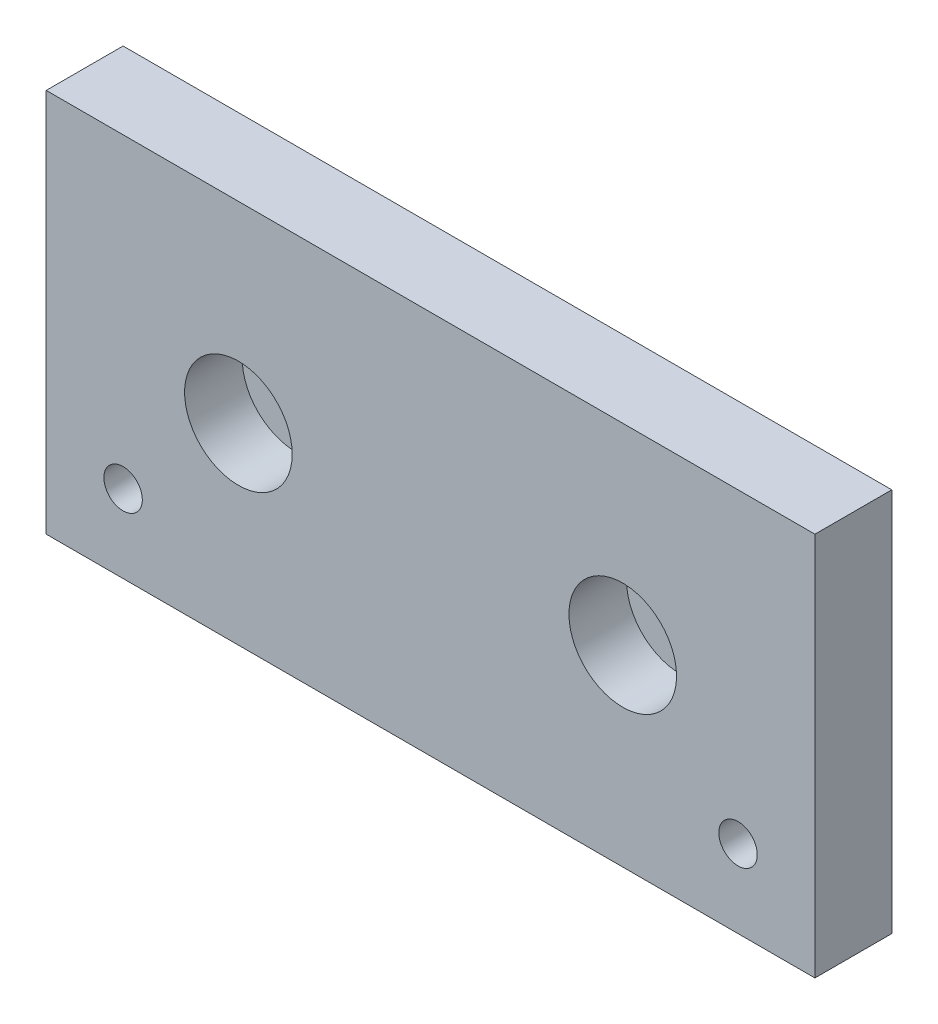
from build123d import *

# Parameters (mm, degrees)
SKETCH1_W           = 200
SKETCH1_H           = 100
BOSS_EXTRUDE1_DEPTH = 20
SKETCH2_R           = 14
CUT_EXTRUDE1_DEPTH  = 15
SKETCH4_R           = 5
CUT_EXTRUDE3_DEPTH  = 114.578166916


with BuildPart() as part:
    # Sketch1 → Boss-Extrude1 (new body)
    with BuildSketch(Plane.XY):
        Rectangle(SKETCH1_W, SKETCH1_H)
    extrude(amount=BOSS_EXTRUDE1_DEPTH)

    # Sketch2 → Cut-Extrude1 (cut)
    with BuildSketch(Plane.XY.offset(20)):
        with Locations((-50, 0)):
            Circle(SKETCH2_R)
        with Locations(Location((50, 0, 0), (0, 0, 180))):
            Circle(SKETCH2_R)
    extrude(amount=-CUT_EXTRUDE1_DEPTH, mode=Mode.SUBTRACT)

    # Sketch4 → Cut-Extrude3 (cut, through all)
    with BuildSketch(Plane(origin=(0, 0, 0), x_dir=(-1, 0, 0), z_dir=(0, 0, -1))):
        with Locations((-80, -29.75)):
            Circle(SKETCH4_R)
        with Locations((80, -29.75)):
            Circle(SKETCH4_R)
    extrude(amount=-CUT_EXTRUDE3_DEPTH, mode=Mode.SUBTRACT)


solid = part.part
